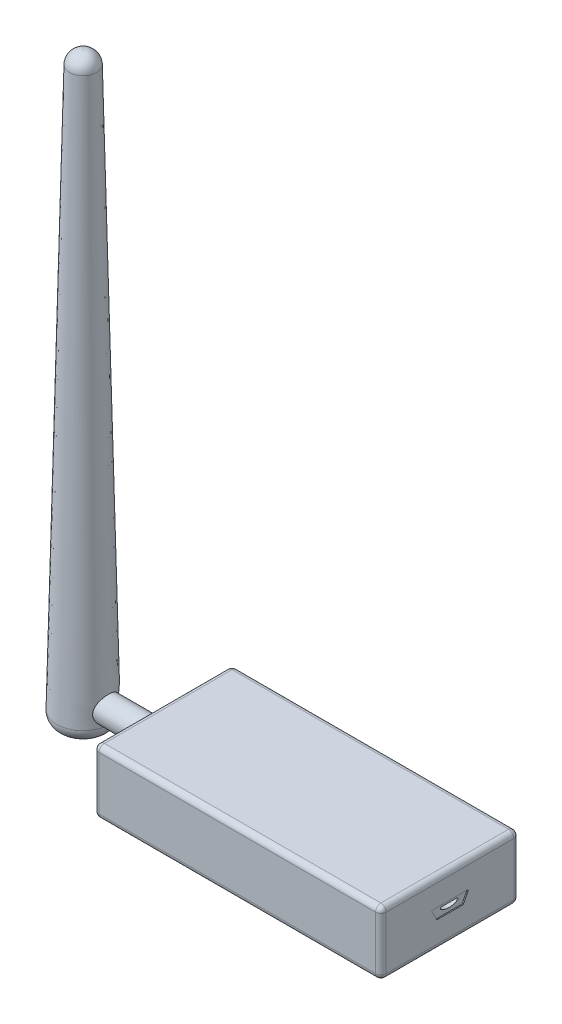
from build123d import *

# Parameters (mm, degrees)
FILLET1_R           = 2.5
SKETCH2_R           = 2.443196487
BOSS_EXTRUDE1_DEPTH = 15
SKETCH3_W           = 26
SKETCH3_H           = 12
BOSS_EXTRUDE2_DEPTH = 54
FILLET2_R           = 1
CUT_EXTRUDE3_DEPTH  = 0.2
CUT_EXTRUDE4_DEPTH  = 5


with BuildPart() as part:
    # Sketch1 → Revolve1 (revolve)
    with BuildSketch(Plane.XY, mode=Mode.PRIVATE) as revolve1_sk:
        Polygon((0, 0), (0, 110), (2.5, 110), (5, 0), align=None)
    revolve(revolve1_sk.sketch.rotate(Axis((0, 0, 0), (0, 1, 0)), 90), axis=Axis((0, 0, 0), (0, 1, 0)))

    # Fillet1
    fillet1_edges = [part.edges().sort_by_distance(p)[0] for p in [
        (0, 110, 2.5),
        (0, 0, 5),
    ]]
    fillet(fillet1_edges, radius=FILLET1_R)

    # Sketch2 → Boss-Extrude1 (add)
    with BuildSketch(Plane(origin=(0, 0, 0), x_dir=(0, 0, -1), z_dir=(1, 0, 0))):
        with Locations(Location((0, 5, 0), (0, 0, 269.999999999))):
            Circle(SKETCH2_R)
    extrude(amount=BOSS_EXTRUDE1_DEPTH)

    # Sketch3 → Boss-Extrude2 (add)
    with BuildSketch(Plane(origin=(15, 0, 0), x_dir=(0, 0, -1), z_dir=(1, 0, 0))):
        with Locations((0, 5)):
            Rectangle(SKETCH3_W, SKETCH3_H)
    extrude(amount=BOSS_EXTRUDE2_DEPTH)

    # Fillet2
    fillet2_edges = [part.edges().sort_by_distance(p)[0] for p in [
        (15, 5, -13),
        (42, -1, -13),
        (15, 11, 0),
        (42, 11, -13),
        (15, 5, 13),
        (42, 11, 13),
        (15, -1, 0),
        (42, -1, 13),
        (69, 5, -13),
        (69, 11, 0),
        (69, 5, 13),
        (69, -1, 0),
    ]]
    fillet(fillet2_edges, radius=FILLET2_R)

    # Sketch6 → Cut-Extrude3 (cut)
    with BuildSketch(Plane(origin=(69, 0, 0), x_dir=(0, 0, -1), z_dir=(1, 0, 0))):
        with BuildLine():
            Line((-3.176393202, 6), (3.176393202, 6))
            ThreePointArc((3.176393202, 6), (3.346523364, 5.905146222), (3.35527864, 5.710557281))
            Line((3.35527864, 5.710557281), (2.55527864, 4.110557281))
            ThreePointArc((2.55527864, 4.110557281), (2.481539425, 4.029869838), (2.376393202, 4))
            Line((2.376393202, 4), (-2.376393202, 4))
            ThreePointArc((-2.376393202, 4), (-2.481539425, 4.029869838), (-2.55527864, 4.110557281))
            Line((-2.55527864, 4.110557281), (-3.35527864, 5.710557281))
            ThreePointArc((-3.35527864, 5.710557281), (-3.346523364, 5.905146222), (-3.176393202, 6))
        make_face()
    extrude(amount=-CUT_EXTRUDE3_DEPTH, mode=Mode.SUBTRACT)

    # Sketch8 → Cut-Extrude4 (cut)
    with BuildSketch(Plane(origin=(68.8, 0, 0), x_dir=(0, 0, -1), z_dir=(1, 0, 0))):
        with BuildLine():
            Line((0.047682537, 5.471989403), (1.485955512, 5.471989403))
            ThreePointArc((1.485955512, 5.471989403), (1.677632452, 5.32908538), (1.595395333, 5.104588908))
            ThreePointArc((1.595395333, 5.104588908), (0.047682537, 4.643562278), (-1.500030259, 5.104588908))
            ThreePointArc((-1.500030259, 5.104588908), (-1.582267378, 5.32908538), (-1.390590438, 5.471989403))
            Line((-1.390590438, 5.471989403), (0.047682537, 5.471989403))
        make_face()
    extrude(amount=-CUT_EXTRUDE4_DEPTH, mode=Mode.SUBTRACT)


solid = part.part
